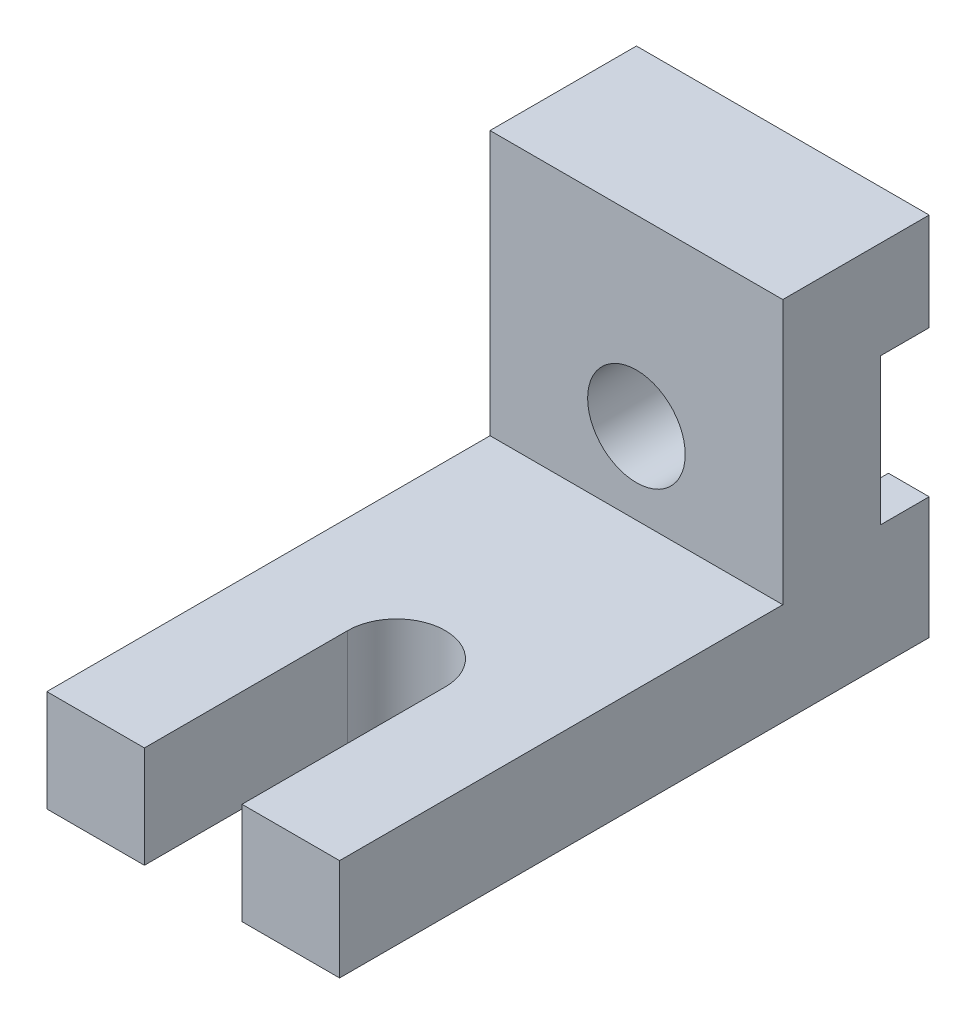
from build123d import *

# Parameters (mm, degrees)
SKETCH1_W           = 1828.8
SKETCH1_H           = 2286
BOSS_EXTRUDE1_DEPTH = 914.4
SKETCH2_W           = 1828.8
SKETCH2_H           = 635
BOSS_EXTRUDE2_DEPTH = 2768.6
CUT_EXTRUDE1_DEPTH  = 4139.407587466
SKETCH4_W           = 1270
SKETCH4_H           = 1828.8
CUT_EXTRUDE2_DEPTH  = 152.4
CUT_EXTRUDE3_DEPTH  = 304.8
SKETCH6_R           = 304.8
CUT_EXTRUDE4_DEPTH  = 3682.685972486


with BuildPart() as part:
    # Sketch1 → Boss-Extrude1 (new body)
    with BuildSketch(Plane.XY):
        Rectangle(SKETCH1_W, SKETCH1_H)
    extrude(amount=BOSS_EXTRUDE1_DEPTH)

    # Sketch2 → Boss-Extrude2 (add)
    with BuildSketch(Plane.XY.offset(914.4)):
        with Locations((0, -825.5)):
            Rectangle(SKETCH2_W, SKETCH2_H)
    extrude(amount=BOSS_EXTRUDE2_DEPTH)

    # Sketch3 → Cut-Extrude1 (cut, through all)
    with BuildSketch(Plane(origin=(0, -508, 0), x_dir=(1, 0, 0), z_dir=(0, 1, 0))):
        with BuildLine():
            Line((304.8, -3683), (304.8, -2413))
            ThreePointArc((304.8, -2413), (0, -2108.2), (-304.8, -2413))
            Line((-304.8, -2413), (-304.8, -3683))
            Line((-304.8, -3683), (304.8, -3683))
        make_face()
    extrude(amount=-CUT_EXTRUDE1_DEPTH, mode=Mode.SUBTRACT)

    # Sketch4 → Cut-Extrude2 (cut)
    with BuildSketch(Plane.XZ.offset(1143)):
        with Locations((-279.4, 914.4)):
            Rectangle(SKETCH4_W, SKETCH4_H)
    extrude(amount=-CUT_EXTRUDE2_DEPTH, mode=Mode.SUBTRACT)

    # Sketch5 → Cut-Extrude3 (cut)
    with BuildSketch(Plane(origin=(0, 0, 0), x_dir=(-1, 0, 0), z_dir=(0, 0, -1))):
        with BuildLine():
            Line((-914.4, 533.4), (-544.176846255, 533.4))
            ThreePointArc((-544.176846255, 533.4), (0, 762), (544.176846255, 533.4))
            Line((544.176846255, 533.4), (914.4, 533.4))
            Line((914.4, 533.4), (914.4, -381))
            Line((914.4, -381), (659.911357684, -381))
            ThreePointArc((659.911357684, -381), (0, -762), (-659.911357684, -381))
            Line((-659.911357684, -381), (-914.4, -381))
            Line((-914.4, -381), (-914.4, 533.4))
        make_face()
    extrude(amount=-CUT_EXTRUDE3_DEPTH, mode=Mode.SUBTRACT)

    # Sketch6 → Cut-Extrude4 (cut, through all)
    with BuildSketch(Plane(origin=(0, 0, 304.8), x_dir=(-1, 0, 0), z_dir=(0, 0, -1))):
        Circle(SKETCH6_R)
    extrude(amount=-CUT_EXTRUDE4_DEPTH, mode=Mode.SUBTRACT)


solid = part.part
